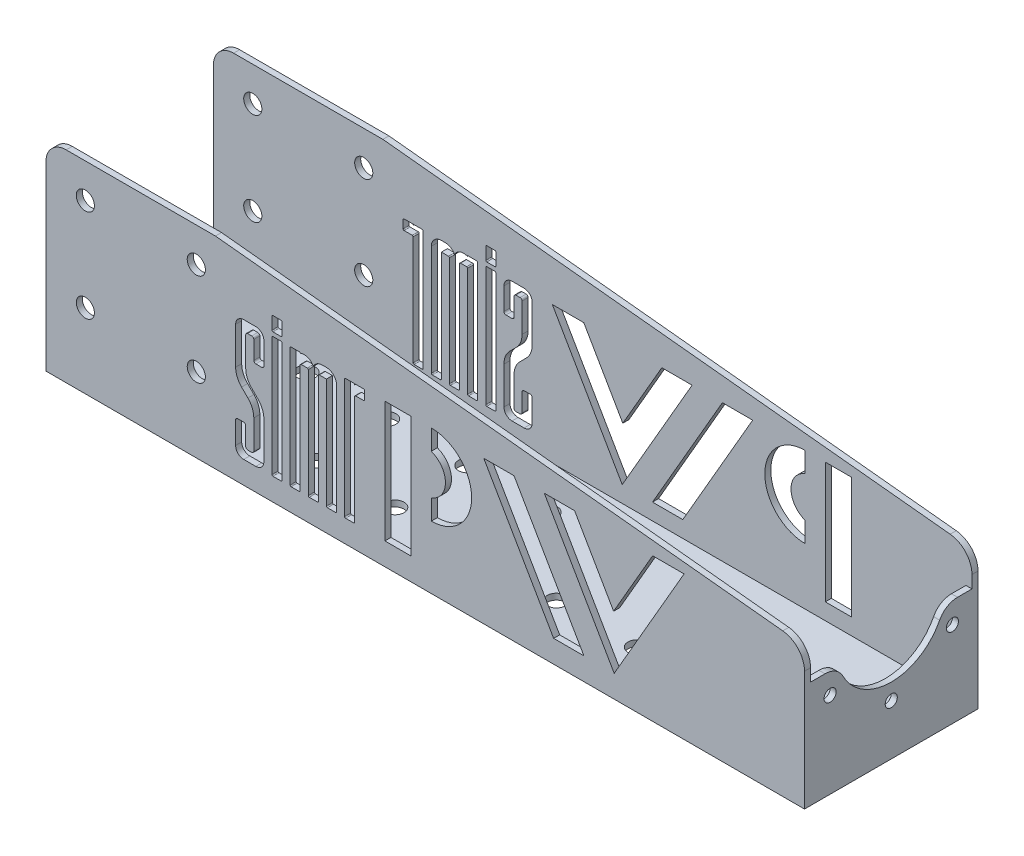
from build123d import *

# Parameters (mm, degrees)
SZKIC1_W                        = 376
SZKIC1_H                        = 86
DODANIE_WYCI_GNI_CIE1_DEPTH     = 100
SZKIC2_W                        = 80
SZKIC2_H                        = 97
WYTNIJ_WYCI_GNI_CIE1_DEPTH      = 392.439650521
WYTNIJ_WYCI_GNI_CIE2_DEPTH      = 230.651910508
WYTNIJ_WYCI_GNI_CIE2_DEPTH_BACK = 100
ZAOKR_GLENIE1_R                 = 12
ZAOKR_GLENIE2_R                 = 10
SZKIC4_R                        = 4.5
WYTNIJ_WYCI_GNI_CIE3_DEPTH      = 230.651910508
SZKIC6_W                        = 3
SZKIC6_H                        = 80
DODANIE_WYCI_GNI_CIE2_DEPTH     = 50
SZKIC7_R                        = 27
WYTNIJ_WYCI_GNI_CIE4_DEPTH      = 392.439650521
ZAOKR_GLENIE3_R                 = 10
SZKIC8_R                        = 3
WYTNIJ_WYCI_GNI_CIE5_DEPTH      = 392.439650521
WYTNIJ_WYCI_GNI_CIE6_REACH      = 231.652
SZKIC9_W                        = 13
SZKIC9_H                        = 60
WYTNIJ_WYCI_GNI_CIE7_REACH      = 231.652
SZKIC11_W                       = 13
SZKIC11_H                       = 60
SZKIC5_R                        = 4.5
WYTNIJ_WYCI_GNI_CIE8_DEPTH      = 218.239499171


with BuildPart() as part:
    # Szkic1 → Dodanie-wyciągnięcie1 (new body)
    with BuildSketch(Plane(origin=(0, 0, 0), x_dir=(1, 0, 0), z_dir=(0, 1, 0))):
        Rectangle(SZKIC1_W, SZKIC1_H)
    extrude(amount=DODANIE_WYCI_GNI_CIE1_DEPTH)

    # Szkic2 → Wytnij-wyciągnięcie1 (cut, through all)
    with BuildSketch(Plane(origin=(188, 0, 0), x_dir=(0, 0, -1), z_dir=(1, 0, 0))):
        with Locations((0, 51.5)):
            Rectangle(SZKIC2_W, SZKIC2_H)
    extrude(amount=-WYTNIJ_WYCI_GNI_CIE1_DEPTH, mode=Mode.SUBTRACT)

    # Szkic3 → Wytnij-wyciągnięcie2 (cut, two sides: drawn at the far end of the back side and taken through both)
    with BuildSketch(Plane.XY.offset(43).offset(-WYTNIJ_WYCI_GNI_CIE2_DEPTH_BACK)):
        Polygon((188, 100), (-104, 100), (188, 70), align=None)
    extrude(amount=WYTNIJ_WYCI_GNI_CIE2_DEPTH + WYTNIJ_WYCI_GNI_CIE2_DEPTH_BACK, mode=Mode.SUBTRACT)

    # Zaokrąglenie1
    zaokr_glenie1_edges = [part.edges().sort_by_distance(p)[0] for p in [
        (188, 70, -41.5),
        (188, 70, 41.5),
    ]]
    fillet(zaokr_glenie1_edges, radius=ZAOKR_GLENIE1_R)

    # Zaokrąglenie2
    zaokr_glenie2_edges = [part.edges().sort_by_distance(p)[0] for p in [
        (-188, 100, -41.5),
        (-188, 100, 41.5),
    ]]
    fillet(zaokr_glenie2_edges, radius=ZAOKR_GLENIE2_R)

    # Szkic4 → Wytnij-wyciągnięcie3 (cut, through all)
    with BuildSketch(Plane.XY.offset(43)):
        with Locations((-168.5, 83)):
            Circle(SZKIC4_R)
        with Locations((-168.5, 37)):
            Circle(SZKIC4_R)
        with Locations(Location((-113.5, 37, 0), (0, 0, 90))):
            Circle(SZKIC4_R)
        with Locations(Location((-113.5, 83, 0), (0, 0, 90))):
            Circle(SZKIC4_R)
    extrude(amount=-WYTNIJ_WYCI_GNI_CIE3_DEPTH, mode=Mode.SUBTRACT)

    # Szkic6 → Dodanie-wyciągnięcie2 (add)
    with BuildSketch(Plane(origin=(0, 3, 0), x_dir=(1, 0, 0), z_dir=(0, 1, 0))):
        with Locations((186.5, 0)):
            Rectangle(SZKIC6_W, SZKIC6_H)
    extrude(amount=DODANIE_WYCI_GNI_CIE2_DEPTH)

    # Szkic7 → Wytnij-wyciągnięcie4 (cut, through all)
    with BuildSketch(Plane(origin=(188, 0, 0), x_dir=(0, 0, -1), z_dir=(1, 0, 0))):
        with Locations((0, 60)):
            Circle(SZKIC7_R)
    extrude(amount=-WYTNIJ_WYCI_GNI_CIE4_DEPTH, mode=Mode.SUBTRACT)

    # Zaokrąglenie3
    zaokr_glenie3_edges = [part.edges().sort_by_distance(p)[0] for p in [
        (186.5, 53, 26.076809621),
        (186.5, 53, -26.076809621),
    ]]
    fillet(zaokr_glenie3_edges, radius=ZAOKR_GLENIE3_R)

    # Szkic8 → Wytnij-wyciągnięcie5 (cut, through all)
    with BuildSketch(Plane(origin=(188, 0, 0), x_dir=(0, 0, -1), z_dir=(1, 0, 0))):
        with Locations((0, 25)):
            Circle(SZKIC8_R)
        with Locations((-30.310889132, 42.5)):
            Circle(SZKIC8_R)
        with Locations((30.310889132, 42.5)):
            Circle(SZKIC8_R)
    extrude(amount=-WYTNIJ_WYCI_GNI_CIE5_DEPTH, mode=Mode.SUBTRACT)

    # Szkic9 → Wytnij-wyciągnięcie6 (cut, up to next)
    with BuildSketch(Plane.XY.offset(43), mode=Mode.PRIVATE) as wytnij_wyci_gni_cie6_sk1:
        with BuildLine():
            Line((-84, 55.106874556), (-81, 55.106874556))
            ThreePointArc((-81, 55.106874556), (-80.292893219, 55.399767775), (-80, 56.106874556))
            Line((-80, 56.106874556), (-80, 67.106874556))
            ThreePointArc((-80, 67.106874556), (-81.171572875, 69.935301681), (-84, 71.106874556))
            Line((-84, 71.106874556), (-90, 71.106874556))
            ThreePointArc((-90, 71.106874556), (-92.828427125, 69.935301681), (-94, 67.106874556))
            Line((-94, 67.106874556), (-94, 48.713476274))
            ThreePointArc((-94, 48.713476274), (-93.238795325, 44.88664195), (-91.071067812, 41.642408462))
            Line((-91.071067812, 41.642408462), (-87.928932188, 38.500272838))
            ThreePointArc((-87.928932188, 38.500272838), (-85.761204675, 35.25603935), (-85, 31.429205026))
            Line((-85, 31.429205026), (-85, 17.106874556))
            ThreePointArc((-85, 17.106874556), (-85.292893219, 16.399767775), (-86, 16.106874556))
            Line((-86, 16.106874556), (-88, 16.106874556))
            ThreePointArc((-88, 16.106874556), (-88.707106781, 16.399767775), (-89, 17.106874556))
            Line((-89, 17.106874556), (-89, 26.106874556))
            ThreePointArc((-89, 26.106874556), (-89.292893219, 26.813981337), (-90, 27.106874556))
            Line((-90, 27.106874556), (-93, 27.106874556))
            ThreePointArc((-93, 27.106874556), (-93.707106781, 26.813981337), (-94, 26.106874556))
            Line((-94, 26.106874556), (-94, 15.106874556))
            ThreePointArc((-94, 15.106874556), (-92.828427125, 12.278447431), (-90, 11.106874556))
            Line((-90, 11.106874556), (-84, 11.106874556))
            ThreePointArc((-84, 11.106874556), (-81.171572875, 12.278447431), (-80, 15.106874556))
            Line((-80, 15.106874556), (-80, 33.500272838))
            ThreePointArc((-80, 33.500272838), (-80.761204675, 37.327107162), (-82.928932188, 40.57134065))
            Line((-82.928932188, 40.57134065), (-86.071067812, 43.713476274))
            ThreePointArc((-86.071067812, 43.713476274), (-88.238795325, 46.957709762), (-89, 50.784544086))
            Line((-89, 50.784544086), (-89, 65.106874556))
            ThreePointArc((-89, 65.106874556), (-88.707106781, 65.813981337), (-88, 66.106874556))
            Line((-88, 66.106874556), (-86, 66.106874556))
            ThreePointArc((-86, 66.106874556), (-85.292893219, 65.813981337), (-85, 65.106874556))
            Line((-85, 65.106874556), (-85, 56.106874556))
            ThreePointArc((-85, 56.106874556), (-84.707106781, 55.399767775), (-84, 55.106874556))
        make_face()
    wytnij_wyci_gni_cie6_tool1 = extrude(wytnij_wyci_gni_cie6_sk1.sketch, amount=-WYTNIJ_WYCI_GNI_CIE6_REACH, mode=Mode.PRIVATE) & part.part
    # Szkic9 → Wytnij-wyciągnięcie6 (cut, up to next)
    with BuildSketch(Plane.XY.offset(43), mode=Mode.PRIVATE) as wytnij_wyci_gni_cie6_sk2:
        with BuildLine():
            Line((-75.5, 71.106874556), (-71.5, 71.106874556))
            ThreePointArc((-71.5, 71.106874556), (-71.146446609, 70.960427946), (-71, 70.606874556))
            Line((-71, 70.606874556), (-71, 11.606874556))
            ThreePointArc((-71, 11.606874556), (-71.146446609, 11.253321165), (-71.5, 11.106874556))
            Line((-71.5, 11.106874556), (-75.5, 11.106874556))
            ThreePointArc((-75.5, 11.106874556), (-75.853553391, 11.253321165), (-76, 11.606874556))
            Line((-76, 11.606874556), (-76, 70.606874556))
            ThreePointArc((-76, 70.606874556), (-75.853553391, 70.960427946), (-75.5, 71.106874556))
        make_face()
    wytnij_wyci_gni_cie6_tool2 = extrude(wytnij_wyci_gni_cie6_sk2.sketch, amount=-WYTNIJ_WYCI_GNI_CIE6_REACH, mode=Mode.PRIVATE) & part.part
    # Szkic9 → Wytnij-wyciągnięcie6 (cut, up to next)
    with BuildSketch(Plane.XY.offset(43), mode=Mode.PRIVATE) as wytnij_wyci_gni_cie6_sk3:
        with BuildLine():
            Line((-75.5, 73.106874556), (-71.5, 73.106874556))
            ThreePointArc((-71.5, 73.106874556), (-71.146446609, 73.253321165), (-71, 73.606874556))
            Line((-71, 73.606874556), (-71, 79.606874556))
            ThreePointArc((-71, 79.606874556), (-71.146446609, 79.960427946), (-71.5, 80.106874556))
            Line((-71.5, 80.106874556), (-75.5, 80.106874556))
            ThreePointArc((-75.5, 80.106874556), (-75.853553391, 79.960427946), (-76, 79.606874556))
            Line((-76, 79.606874556), (-76, 73.606874556))
            ThreePointArc((-76, 73.606874556), (-75.853553391, 73.253321165), (-75.5, 73.106874556))
        make_face()
    wytnij_wyci_gni_cie6_tool3 = extrude(wytnij_wyci_gni_cie6_sk3.sketch, amount=-WYTNIJ_WYCI_GNI_CIE6_REACH, mode=Mode.PRIVATE) & part.part
    # Szkic9 → Wytnij-wyciągnięcie6 (cut, up to next)
    with BuildSketch(Plane.XY.offset(43), mode=Mode.PRIVATE) as wytnij_wyci_gni_cie6_sk4:
        with BuildLine():
            Line((-67, 70.606874556), (-67, 11.606874556))
            ThreePointArc((-67, 11.606874556), (-66.853553391, 11.253321165), (-66.5, 11.106874556))
            Line((-66.5, 11.106874556), (-62.5, 11.106874556))
            ThreePointArc((-62.5, 11.106874556), (-62.146446609, 11.253321165), (-62, 11.606874556))
            Line((-62, 11.606874556), (-62, 65.606874556))
            ThreePointArc((-62, 65.606874556), (-61.853553391, 65.960427946), (-61.5, 66.106874556))
            Line((-61.5, 66.106874556), (-58.5, 66.106874556))
            ThreePointArc((-58.5, 66.106874556), (-58.146446609, 65.960427946), (-58, 65.606874556))
            Line((-58, 65.606874556), (-58, 11.606874556))
            ThreePointArc((-58, 11.606874556), (-57.853553391, 11.253321165), (-57.5, 11.106874556))
            Line((-57.5, 11.106874556), (-53.5, 11.106874556))
            ThreePointArc((-53.5, 11.106874556), (-53.146446609, 11.253321165), (-53, 11.606874556))
            Line((-53, 11.606874556), (-53, 65.606874556))
            ThreePointArc((-53, 65.606874556), (-52.853553391, 65.960427946), (-52.5, 66.106874556))
            Line((-52.5, 66.106874556), (-49, 66.106874556))
            Line((-49, 66.106874556), (-49, 11.606874556))
            ThreePointArc((-49, 11.606874556), (-48.853553391, 11.253321165), (-48.5, 11.106874556))
            Line((-48.5, 11.106874556), (-44.5, 11.106874556))
            ThreePointArc((-44.5, 11.106874556), (-44.146446609, 11.253321165), (-44, 11.606874556))
            Line((-44, 11.606874556), (-44, 66.106874556))
            ThreePointArc((-44, 66.106874556), (-45.464466094, 69.642408462), (-49, 71.106874556))
            Line((-49, 71.106874556), (-51, 71.106874556))
            ThreePointArc((-51, 71.106874556), (-53.655442773, 70.343456159), (-55.5, 68.286324028))
            ThreePointArc((-55.5, 68.286324028), (-57.344557227, 70.343456159), (-60, 71.106874556))
            ThreePointArc((-60, 71.106874556), (-61.021548218, 71.00140612), (-62, 70.689450251))
            Line((-62, 70.689450251), (-62, 71.106874556))
            Line((-62, 71.106874556), (-66.5, 71.106874556))
            ThreePointArc((-66.5, 71.106874556), (-66.853553391, 70.960427946), (-67, 70.606874556))
        make_face()
    wytnij_wyci_gni_cie6_tool4 = extrude(wytnij_wyci_gni_cie6_sk4.sketch, amount=-WYTNIJ_WYCI_GNI_CIE6_REACH, mode=Mode.PRIVATE) & part.part
    # Szkic9 → Wytnij-wyciągnięcie6 (cut, up to next)
    with BuildSketch(Plane.XY.offset(43), mode=Mode.PRIVATE) as wytnij_wyci_gni_cie6_sk5:
        with BuildLine():
            Line((-30, 70.606874556), (-30, 66.606874556))
            ThreePointArc((-30, 66.606874556), (-30.146446609, 66.253321165), (-30.5, 66.106874556))
            Line((-30.5, 66.106874556), (-34.5, 66.106874556))
            ThreePointArc((-34.5, 66.106874556), (-34.853553391, 65.960427946), (-35, 65.606874556))
            Line((-35, 65.606874556), (-35, 11.606874556))
            ThreePointArc((-35, 11.606874556), (-35.146446609, 11.253321165), (-35.5, 11.106874556))
            Line((-35.5, 11.106874556), (-39.5, 11.106874556))
            ThreePointArc((-39.5, 11.106874556), (-39.853553391, 11.253321165), (-40, 11.606874556))
            Line((-40, 11.606874556), (-40, 70.606874556))
            ThreePointArc((-40, 70.606874556), (-39.853553391, 70.960427946), (-39.5, 71.106874556))
            Line((-39.5, 71.106874556), (-35, 71.106874556))
            Line((-35, 71.106874556), (-35, 70.606874556))
            ThreePointArc((-35, 70.606874556), (-34.853553391, 70.960427946), (-34.5, 71.106874556))
            Line((-34.5, 71.106874556), (-30.5, 71.106874556))
            ThreePointArc((-30.5, 71.106874556), (-30.146446609, 70.960427946), (-30, 70.606874556))
        make_face()
    wytnij_wyci_gni_cie6_tool5 = extrude(wytnij_wyci_gni_cie6_sk5.sketch, amount=-WYTNIJ_WYCI_GNI_CIE6_REACH, mode=Mode.PRIVATE) & part.part
    # Szkic9 → Wytnij-wyciągnięcie6 (cut, up to next)
    with BuildSketch(Plane.XY.offset(43), mode=Mode.PRIVATE) as wytnij_wyci_gni_cie6_sk6:
        with BuildLine():
            Line((3, 41.106874556), (3, 31.106874556))
            ThreePointArc((3, 31.106874556), (23, 51.106874556), (3, 71.106874556))
            Line((3, 71.106874556), (3, 61.106874556))
            ThreePointArc((3, 61.106874556), (10, 51.106874556), (3, 41.106874556))
        make_face()
    wytnij_wyci_gni_cie6_tool6 = extrude(wytnij_wyci_gni_cie6_sk6.sketch, amount=-WYTNIJ_WYCI_GNI_CIE6_REACH, mode=Mode.PRIVATE) & part.part
    # Szkic9 → Wytnij-wyciągnięcie6 (cut, up to next)
    with BuildSketch(Plane.XY.offset(43), mode=Mode.PRIVATE) as wytnij_wyci_gni_cie6_sk7:
        with Locations((-13.5, 41.106874556)):
            Rectangle(SZKIC9_W, SZKIC9_H)
    wytnij_wyci_gni_cie6_tool7 = extrude(wytnij_wyci_gni_cie6_sk7.sketch, amount=-WYTNIJ_WYCI_GNI_CIE6_REACH, mode=Mode.PRIVATE) & part.part
    # Szkic9 → Wytnij-wyciągnięcie6 (cut, up to next)
    with BuildSketch(Plane.XY.offset(43), mode=Mode.PRIVATE) as wytnij_wyci_gni_cie6_sk8:
        Polygon((29, 71.106874556), (63.641016151, 11.106874556), (78.65212315, 11.106874556), (44.011106999, 71.106874556), align=None)
    wytnij_wyci_gni_cie6_tool8 = extrude(wytnij_wyci_gni_cie6_sk8.sketch, amount=-WYTNIJ_WYCI_GNI_CIE6_REACH, mode=Mode.PRIVATE) & part.part
    # Szkic9 → Wytnij-wyciągnięcie6 (cut, up to next)
    with BuildSketch(Plane.XY.offset(43), mode=Mode.PRIVATE) as wytnij_wyci_gni_cie6_sk9:
        Polygon((59.022213998, 71.106874556), (93.663230149, 11.106874556), (128.304246301, 71.106874556), (112.715789032, 71.106874556), (93.374555015, 37.606874556), (74.033320997, 71.106874556), align=None)
    wytnij_wyci_gni_cie6_tool9 = extrude(wytnij_wyci_gni_cie6_sk9.sketch, amount=-WYTNIJ_WYCI_GNI_CIE6_REACH, mode=Mode.PRIVATE) & part.part
    add(wytnij_wyci_gni_cie6_tool1.solids().sort_by_distance((-87, 41.106875, 43))[0], mode=Mode.SUBTRACT)
    add(wytnij_wyci_gni_cie6_tool2.solids().sort_by_distance((-73.5, 41.106875, 43))[0], mode=Mode.SUBTRACT)
    add(wytnij_wyci_gni_cie6_tool3.solids().sort_by_distance((-73.5, 76.606875, 43))[0], mode=Mode.SUBTRACT)
    add(wytnij_wyci_gni_cie6_tool4.solids().sort_by_distance((-55.558036, 41.903643, 43))[0], mode=Mode.SUBTRACT)
    add(wytnij_wyci_gni_cie6_tool5.solids().sort_by_distance((-37.117114, 43.219032, 43))[0], mode=Mode.SUBTRACT)
    add(wytnij_wyci_gni_cie6_tool6.solids().sort_by_distance((12.570739, 51.106875, 43))[0], mode=Mode.SUBTRACT)
    add(wytnij_wyci_gni_cie6_tool7.solids().sort_by_distance((-13.5, 41.106875, 43))[0], mode=Mode.SUBTRACT)
    add(wytnij_wyci_gni_cie6_tool8.solids().sort_by_distance((53.826062, 41.106875, 43))[0], mode=Mode.SUBTRACT)
    add(wytnij_wyci_gni_cie6_tool9.solids().sort_by_distance((77.136447, 41.565132, 43))[0], mode=Mode.SUBTRACT)

    # Szkic11 → Wytnij-wyciągnięcie7 (cut, up to next)
    with BuildSketch(Plane(origin=(0, 0, -43), x_dir=(-1, 0, 0), z_dir=(0, 0, -1)), mode=Mode.PRIVATE) as wytnij_wyci_gni_cie7_sk1:
        with BuildLine():
            Line((40, 55.106874556), (43, 55.106874556))
            ThreePointArc((43, 55.106874556), (43.707106781, 55.399767775), (44, 56.106874556))
            Line((44, 56.106874556), (44, 67.106874556))
            ThreePointArc((44, 67.106874556), (42.828427125, 69.935301681), (40, 71.106874556))
            Line((40, 71.106874556), (34, 71.106874556))
            ThreePointArc((34, 71.106874556), (31.171572875, 69.935301681), (30, 67.106874556))
            Line((30, 67.106874556), (30, 48.713476274))
            ThreePointArc((30, 48.713476274), (30.761204675, 44.88664195), (32.928932188, 41.642408462))
            Line((32.928932188, 41.642408462), (36.071067812, 38.500272838))
            ThreePointArc((36.071067812, 38.500272838), (38.238795325, 35.25603935), (39, 31.429205026))
            Line((39, 31.429205026), (39, 17.106874556))
            ThreePointArc((39, 17.106874556), (38.707106781, 16.399767775), (38, 16.106874556))
            Line((38, 16.106874556), (36, 16.106874556))
            ThreePointArc((36, 16.106874556), (35.292893219, 16.399767775), (35, 17.106874556))
            Line((35, 17.106874556), (35, 26.106874556))
            ThreePointArc((35, 26.106874556), (34.707106781, 26.813981337), (34, 27.106874556))
            Line((34, 27.106874556), (31, 27.106874556))
            ThreePointArc((31, 27.106874556), (30.292893219, 26.813981337), (30, 26.106874556))
            Line((30, 26.106874556), (30, 15.106874556))
            ThreePointArc((30, 15.106874556), (31.171572875, 12.278447431), (34, 11.106874556))
            Line((34, 11.106874556), (40, 11.106874556))
            ThreePointArc((40, 11.106874556), (42.828427125, 12.278447431), (44, 15.106874556))
            Line((44, 15.106874556), (44, 33.500272838))
            ThreePointArc((44, 33.500272838), (43.238795325, 37.327107162), (41.071067812, 40.57134065))
            Line((41.071067812, 40.57134065), (37.928932188, 43.713476274))
            ThreePointArc((37.928932188, 43.713476274), (35.761204675, 46.957709762), (35, 50.784544086))
            Line((35, 50.784544086), (35, 65.106874556))
            ThreePointArc((35, 65.106874556), (35.292893219, 65.813981337), (36, 66.106874556))
            Line((36, 66.106874556), (38, 66.106874556))
            ThreePointArc((38, 66.106874556), (38.707106781, 65.813981337), (39, 65.106874556))
            Line((39, 65.106874556), (39, 56.106874556))
            ThreePointArc((39, 56.106874556), (39.292893219, 55.399767775), (40, 55.106874556))
        make_face()
    wytnij_wyci_gni_cie7_tool1 = extrude(wytnij_wyci_gni_cie7_sk1.sketch, amount=-WYTNIJ_WYCI_GNI_CIE7_REACH, mode=Mode.PRIVATE) & part.part
    # Szkic11 → Wytnij-wyciągnięcie7 (cut, up to next)
    with BuildSketch(Plane(origin=(0, 0, -43), x_dir=(-1, 0, 0), z_dir=(0, 0, -1)), mode=Mode.PRIVATE) as wytnij_wyci_gni_cie7_sk2:
        with BuildLine():
            Line((48.5, 71.106874556), (52.5, 71.106874556))
            ThreePointArc((52.5, 71.106874556), (52.853553391, 70.960427946), (53, 70.606874556))
            Line((53, 70.606874556), (53, 11.606874556))
            ThreePointArc((53, 11.606874556), (52.853553391, 11.253321165), (52.5, 11.106874556))
            Line((52.5, 11.106874556), (48.5, 11.106874556))
            ThreePointArc((48.5, 11.106874556), (48.146446609, 11.253321165), (48, 11.606874556))
            Line((48, 11.606874556), (48, 70.606874556))
            ThreePointArc((48, 70.606874556), (48.146446609, 70.960427946), (48.5, 71.106874556))
        make_face()
    wytnij_wyci_gni_cie7_tool2 = extrude(wytnij_wyci_gni_cie7_sk2.sketch, amount=-WYTNIJ_WYCI_GNI_CIE7_REACH, mode=Mode.PRIVATE) & part.part
    # Szkic11 → Wytnij-wyciągnięcie7 (cut, up to next)
    with BuildSketch(Plane(origin=(0, 0, -43), x_dir=(-1, 0, 0), z_dir=(0, 0, -1)), mode=Mode.PRIVATE) as wytnij_wyci_gni_cie7_sk3:
        with BuildLine():
            Line((48.5, 73.106874556), (52.5, 73.106874556))
            ThreePointArc((52.5, 73.106874556), (52.853553391, 73.253321165), (53, 73.606874556))
            Line((53, 73.606874556), (53, 79.606874556))
            ThreePointArc((53, 79.606874556), (52.853553391, 79.960427946), (52.5, 80.106874556))
            Line((52.5, 80.106874556), (48.5, 80.106874556))
            ThreePointArc((48.5, 80.106874556), (48.146446609, 79.960427946), (48, 79.606874556))
            Line((48, 79.606874556), (48, 73.606874556))
            ThreePointArc((48, 73.606874556), (48.146446609, 73.253321165), (48.5, 73.106874556))
        make_face()
    wytnij_wyci_gni_cie7_tool3 = extrude(wytnij_wyci_gni_cie7_sk3.sketch, amount=-WYTNIJ_WYCI_GNI_CIE7_REACH, mode=Mode.PRIVATE) & part.part
    # Szkic11 → Wytnij-wyciągnięcie7 (cut, up to next)
    with BuildSketch(Plane(origin=(0, 0, -43), x_dir=(-1, 0, 0), z_dir=(0, 0, -1)), mode=Mode.PRIVATE) as wytnij_wyci_gni_cie7_sk4:
        with BuildLine():
            Line((57, 70.606874556), (57, 11.606874556))
            ThreePointArc((57, 11.606874556), (57.146446609, 11.253321165), (57.5, 11.106874556))
            Line((57.5, 11.106874556), (61.5, 11.106874556))
            ThreePointArc((61.5, 11.106874556), (61.853553391, 11.253321165), (62, 11.606874556))
            Line((62, 11.606874556), (62, 65.606874556))
            ThreePointArc((62, 65.606874556), (62.146446609, 65.960427946), (62.5, 66.106874556))
            Line((62.5, 66.106874556), (65.5, 66.106874556))
            ThreePointArc((65.5, 66.106874556), (65.853553391, 65.960427946), (66, 65.606874556))
            Line((66, 65.606874556), (66, 11.606874556))
            ThreePointArc((66, 11.606874556), (66.146446609, 11.253321165), (66.5, 11.106874556))
            Line((66.5, 11.106874556), (70.5, 11.106874556))
            ThreePointArc((70.5, 11.106874556), (70.853553391, 11.253321165), (71, 11.606874556))
            Line((71, 11.606874556), (71, 65.606874556))
            ThreePointArc((71, 65.606874556), (71.146446609, 65.960427946), (71.5, 66.106874556))
            Line((71.5, 66.106874556), (75, 66.106874556))
            Line((75, 66.106874556), (75, 11.606874556))
            ThreePointArc((75, 11.606874556), (75.146446609, 11.253321165), (75.5, 11.106874556))
            Line((75.5, 11.106874556), (79.5, 11.106874556))
            ThreePointArc((79.5, 11.106874556), (79.853553391, 11.253321165), (80, 11.606874556))
            Line((80, 11.606874556), (80, 66.106874556))
            ThreePointArc((80, 66.106874556), (78.535533906, 69.642408462), (75, 71.106874556))
            Line((75, 71.106874556), (73, 71.106874556))
            ThreePointArc((73, 71.106874556), (70.344557227, 70.343456159), (68.5, 68.286324028))
            ThreePointArc((68.5, 68.286324028), (66.655442773, 70.343456159), (64, 71.106874556))
            ThreePointArc((64, 71.106874556), (62.978451782, 71.00140612), (62, 70.689450251))
            Line((62, 70.689450251), (62, 71.106874556))
            Line((62, 71.106874556), (57.5, 71.106874556))
            ThreePointArc((57.5, 71.106874556), (57.146446609, 70.960427946), (57, 70.606874556))
        make_face()
    wytnij_wyci_gni_cie7_tool4 = extrude(wytnij_wyci_gni_cie7_sk4.sketch, amount=-WYTNIJ_WYCI_GNI_CIE7_REACH, mode=Mode.PRIVATE) & part.part
    # Szkic11 → Wytnij-wyciągnięcie7 (cut, up to next)
    with BuildSketch(Plane(origin=(0, 0, -43), x_dir=(-1, 0, 0), z_dir=(0, 0, -1)), mode=Mode.PRIVATE) as wytnij_wyci_gni_cie7_sk5:
        with BuildLine():
            Line((94, 70.606874556), (94, 66.606874556))
            ThreePointArc((94, 66.606874556), (93.853553391, 66.253321165), (93.5, 66.106874556))
            Line((93.5, 66.106874556), (89.5, 66.106874556))
            ThreePointArc((89.5, 66.106874556), (89.146446609, 65.960427946), (89, 65.606874556))
            Line((89, 65.606874556), (89, 11.606874556))
            ThreePointArc((89, 11.606874556), (88.853553391, 11.253321165), (88.5, 11.106874556))
            Line((88.5, 11.106874556), (84.5, 11.106874556))
            ThreePointArc((84.5, 11.106874556), (84.146446609, 11.253321165), (84, 11.606874556))
            Line((84, 11.606874556), (84, 70.606874556))
            ThreePointArc((84, 70.606874556), (84.146446609, 70.960427946), (84.5, 71.106874556))
            Line((84.5, 71.106874556), (89, 71.106874556))
            Line((89, 71.106874556), (89, 70.606874556))
            ThreePointArc((89, 70.606874556), (89.146446609, 70.960427946), (89.5, 71.106874556))
            Line((89.5, 71.106874556), (93.5, 71.106874556))
            ThreePointArc((93.5, 71.106874556), (93.853553391, 70.960427946), (94, 70.606874556))
        make_face()
    wytnij_wyci_gni_cie7_tool5 = extrude(wytnij_wyci_gni_cie7_sk5.sketch, amount=-WYTNIJ_WYCI_GNI_CIE7_REACH, mode=Mode.PRIVATE) & part.part
    # Szkic11 → Wytnij-wyciągnięcie7 (cut, up to next)
    with BuildSketch(Plane(origin=(0, 0, -43), x_dir=(-1, 0, 0), z_dir=(0, 0, -1)), mode=Mode.PRIVATE) as wytnij_wyci_gni_cie7_sk6:
        with BuildLine():
            Line((-105.304246301, 41.106874556), (-105.304246301, 31.106874556))
            ThreePointArc((-105.304246301, 31.106874556), (-85.304246301, 51.106874556), (-105.304246301, 71.106874556))
            Line((-105.304246301, 71.106874556), (-105.304246301, 61.106874556))
            ThreePointArc((-105.304246301, 61.106874556), (-98.304246301, 51.106874556), (-105.304246301, 41.106874556))
        make_face()
    wytnij_wyci_gni_cie7_tool6 = extrude(wytnij_wyci_gni_cie7_sk6.sketch, amount=-WYTNIJ_WYCI_GNI_CIE7_REACH, mode=Mode.PRIVATE) & part.part
    # Szkic11 → Wytnij-wyciągnięcie7 (cut, up to next)
    with BuildSketch(Plane(origin=(0, 0, -43), x_dir=(-1, 0, 0), z_dir=(0, 0, -1)), mode=Mode.PRIVATE) as wytnij_wyci_gni_cie7_sk7:
        with Locations((-121.804246301, 41.106874556)):
            Rectangle(SZKIC11_W, SZKIC11_H)
    wytnij_wyci_gni_cie7_tool7 = extrude(wytnij_wyci_gni_cie7_sk7.sketch, amount=-WYTNIJ_WYCI_GNI_CIE7_REACH, mode=Mode.PRIVATE) & part.part
    # Szkic11 → Wytnij-wyciągnięcie7 (cut, up to next)
    with BuildSketch(Plane(origin=(0, 0, -43), x_dir=(-1, 0, 0), z_dir=(0, 0, -1)), mode=Mode.PRIVATE) as wytnij_wyci_gni_cie7_sk8:
        Polygon((-79.304246301, 71.106874556), (-44.663230149, 11.106874556), (-29.65212315, 11.106874556), (-64.293139302, 71.106874556), align=None)
    wytnij_wyci_gni_cie7_tool8 = extrude(wytnij_wyci_gni_cie7_sk8.sketch, amount=-WYTNIJ_WYCI_GNI_CIE7_REACH, mode=Mode.PRIVATE) & part.part
    # Szkic11 → Wytnij-wyciągnięcie7 (cut, up to next)
    with BuildSketch(Plane(origin=(0, 0, -43), x_dir=(-1, 0, 0), z_dir=(0, 0, -1)), mode=Mode.PRIVATE) as wytnij_wyci_gni_cie7_sk9:
        Polygon((-49.282032303, 71.106874556), (-14.641016151, 11.106874556), (20, 71.106874556), (4.411542732, 71.106874556), (-14.929691286, 37.606874556), (-34.270925304, 71.106874556), align=None)
    wytnij_wyci_gni_cie7_tool9 = extrude(wytnij_wyci_gni_cie7_sk9.sketch, amount=-WYTNIJ_WYCI_GNI_CIE7_REACH, mode=Mode.PRIVATE) & part.part
    add(wytnij_wyci_gni_cie7_tool1.solids().sort_by_distance((-37, 41.106875, -43))[0], mode=Mode.SUBTRACT)
    add(wytnij_wyci_gni_cie7_tool2.solids().sort_by_distance((-50.5, 41.106875, -43))[0], mode=Mode.SUBTRACT)
    add(wytnij_wyci_gni_cie7_tool3.solids().sort_by_distance((-50.5, 76.606875, -43))[0], mode=Mode.SUBTRACT)
    add(wytnij_wyci_gni_cie7_tool4.solids().sort_by_distance((-68.441964, 41.903643, -43))[0], mode=Mode.SUBTRACT)
    add(wytnij_wyci_gni_cie7_tool5.solids().sort_by_distance((-86.882886, 43.219032, -43))[0], mode=Mode.SUBTRACT)
    add(wytnij_wyci_gni_cie7_tool6.solids().sort_by_distance((95.733507, 51.106875, -43))[0], mode=Mode.SUBTRACT)
    add(wytnij_wyci_gni_cie7_tool7.solids().sort_by_distance((121.804246, 41.106875, -43))[0], mode=Mode.SUBTRACT)
    add(wytnij_wyci_gni_cie7_tool8.solids().sort_by_distance((54.478185, 41.106875, -43))[0], mode=Mode.SUBTRACT)
    add(wytnij_wyci_gni_cie7_tool9.solids().sort_by_distance((31.167799, 41.565132, -43))[0], mode=Mode.SUBTRACT)

    # Szkic5 → Wytnij-wyciągnięcie8 (cut, through all)
    with BuildSketch(Plane.XZ):
        with Locations(Location((-160, 18, 0), (0, 0, 270))):
            Circle(SZKIC5_R)
        with Locations(Location((-160, -18, 0), (0, 0, 270))):
            Circle(SZKIC5_R)
        with Locations(Location((-120, 18, 0), (0, 0, 270))):
            Circle(SZKIC5_R)
        with Locations(Location((-120, -18, 0), (0, 0, 270))):
            Circle(SZKIC5_R)
        with Locations(Location((-80, 18, 0), (0, 0, 270))):
            Circle(SZKIC5_R)
        with Locations(Location((-80, -18, 0), (0, 0, 270))):
            Circle(SZKIC5_R)
        with Locations(Location((-40, 18, 0), (0, 0, 270))):
            Circle(SZKIC5_R)
        with Locations(Location((-40, -18, 0), (0, 0, 270))):
            Circle(SZKIC5_R)
        with Locations(Location((0, 18, 0), (0, 0, 270))):
            Circle(SZKIC5_R)
        with Locations(Location((0, -18, 0), (0, 0, 270))):
            Circle(SZKIC5_R)
        with Locations(Location((40, 18, 0), (0, 0, 270))):
            Circle(SZKIC5_R)
        with Locations(Location((40, -18, 0), (0, 0, 270))):
            Circle(SZKIC5_R)
        with Locations(Location((80, 18, 0), (0, 0, 270))):
            Circle(SZKIC5_R)
        with Locations(Location((80, -18, 0), (0, 0, 270))):
            Circle(SZKIC5_R)
        with Locations(Location((120, 18, 0), (0, 0, 270))):
            Circle(SZKIC5_R)
        with Locations(Location((120, -18, 0), (0, 0, 270))):
            Circle(SZKIC5_R)
        with Locations(Location((160, 18, 0), (0, 0, 270))):
            Circle(SZKIC5_R)
        with Locations(Location((160, -18, 0), (0, 0, 270))):
            Circle(SZKIC5_R)
    extrude(amount=-WYTNIJ_WYCI_GNI_CIE8_DEPTH, mode=Mode.SUBTRACT)


solid = part.part
